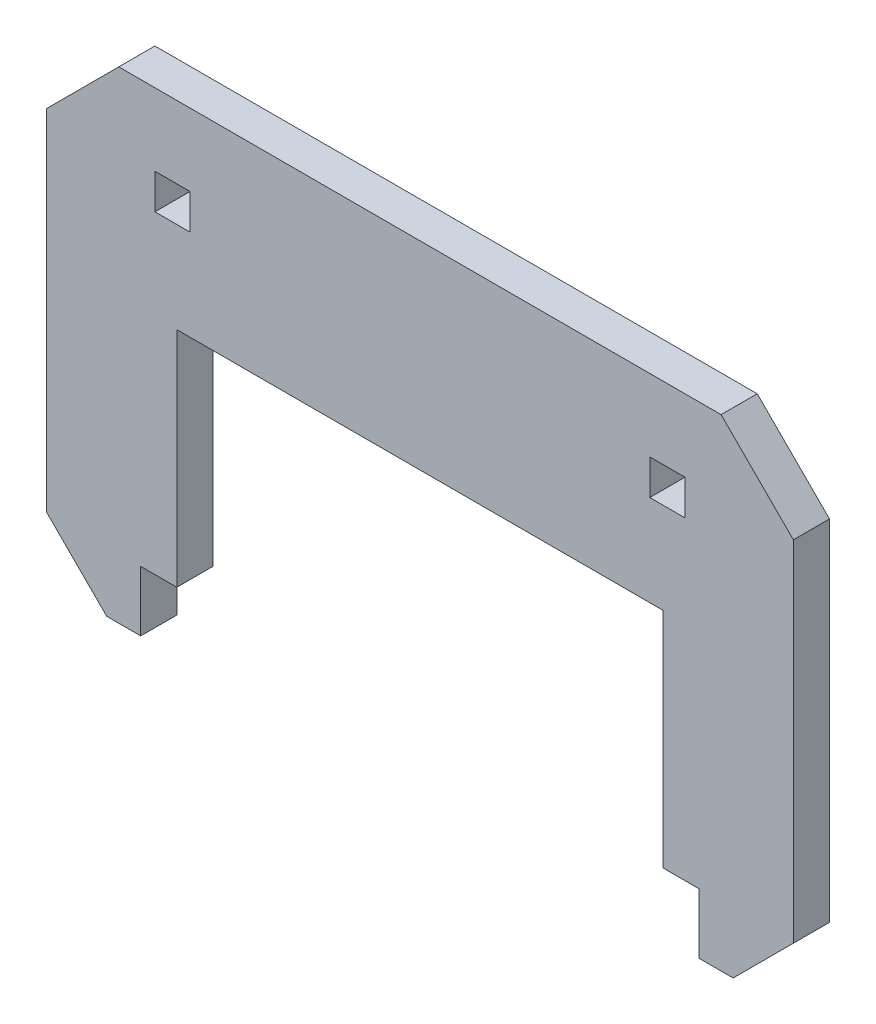
from build123d import *

# Parameters (mm, degrees)
SKETCH1_W           = 2.92
SKETCH1_H           = 2.92
BOSS_EXTRUDE1_DEPTH = 3


with BuildPart() as part:
    # Sketch1 → Boss-Extrude1 (new body)
    with BuildSketch(Plane.XY):
        Polygon((28.134570185, 8.537968033), (22.134570185, 14.537968033), (-27.865429815, 14.537968033), (-33.865429815, 8.537968033), (-33.865429815, -20.462031967), (-28.865429815, -25.462031967), (-26.045429815, -25.462031967), (-26.045429815, -20.462031967), (-23.045429815, -20.462031967), (-23.045429815, -1.942031967), (17.314570185, -1.942031967), (17.314570185, -20.462031967), (20.314570185, -20.462031967), (20.314570185, -25.462031967), (23.134570185, -25.462031967), (28.134570185, -20.462031967), align=None)
        with Locations((-23.405429815, 7.077968033)):
            Rectangle(SKETCH1_W, SKETCH1_H, mode=Mode.SUBTRACT)
        with Locations((17.674570185, 7.077968033)):
            Rectangle(SKETCH1_W, SKETCH1_H, mode=Mode.SUBTRACT)
    extrude(amount=BOSS_EXTRUDE1_DEPTH)


solid = part.part
